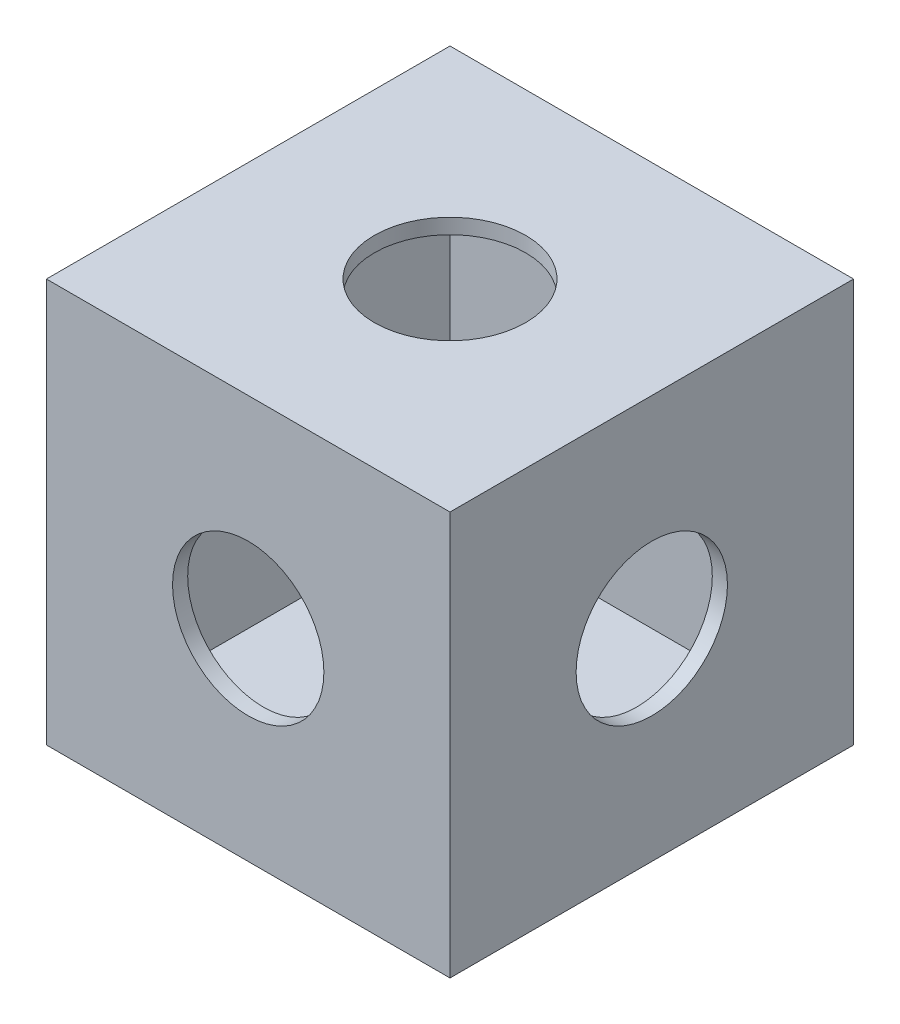
from build123d import *

# Parameters (mm, degrees)
SKETCH1_W           = 40
SKETCH1_H           = 40
BOSS_EXTRUDE2_DEPTH = 1.5
SKETCH2_W           = 40
SKETCH2_H           = 40
SKETCH2_W_2         = 37
SKETCH2_H_2         = 37
BOSS_EXTRUDE3_DEPTH = 37
SKETCH3_W           = 40
SKETCH3_H           = 40
BOSS_EXTRUDE4_DEPTH = 1.5
SKETCH4_R           = 7.5
CUT_EXTRUDE1_DEPTH  = 70.282032303
SKETCH5_R           = 7.5
CUT_EXTRUDE2_DEPTH  = 69.426968368
SKETCH6_R           = 7.5
CUT_EXTRUDE3_DEPTH  = 69.426968368


with BuildPart() as part:
    # Sketch1 → Boss-Extrude2 (new body)
    with BuildSketch(Plane(origin=(0, 0, 0), x_dir=(1, 0, 0), z_dir=(0, 1, 0))):
        with Locations((20, 20)):
            Rectangle(SKETCH1_W, SKETCH1_H)
    extrude(amount=-BOSS_EXTRUDE2_DEPTH)

    # Sketch2 → Boss-Extrude3 (add)
    with BuildSketch(Plane(origin=(0, 0, 0), x_dir=(1, 0, 0), z_dir=(0, 1, 0))):
        with Locations((20, 20)):
            Rectangle(SKETCH2_W, SKETCH2_H)
        with Locations((20, 20)):
            Rectangle(SKETCH2_W_2, SKETCH2_H_2, mode=Mode.SUBTRACT)
    extrude(amount=BOSS_EXTRUDE3_DEPTH)

    # Sketch3 → Boss-Extrude4 (add)
    with BuildSketch(Plane(origin=(0, 37, 0), x_dir=(1, 0, 0), z_dir=(0, 1, 0))):
        with Locations((20, 20)):
            Rectangle(SKETCH3_W, SKETCH3_H)
    extrude(amount=BOSS_EXTRUDE4_DEPTH)

    # Sketch4 → Cut-Extrude1 (cut, through all)
    with BuildSketch(Plane(origin=(0, 38.5, 0), x_dir=(1, 0, 0), z_dir=(0, 1, 0))):
        with Locations(Location((20, 20, 0), (0, 0, 270))):
            Circle(SKETCH4_R)
    extrude(amount=-CUT_EXTRUDE1_DEPTH, mode=Mode.SUBTRACT)

    # Sketch5 → Cut-Extrude2 (cut, through all)
    with BuildSketch(Plane(origin=(40, 0, 0), x_dir=(0, 0, -1), z_dir=(1, 0, 0))):
        with Locations((20, 18.5)):
            Circle(SKETCH5_R)
    extrude(amount=-CUT_EXTRUDE2_DEPTH, mode=Mode.SUBTRACT)

    # Sketch6 → Cut-Extrude3 (cut, through all)
    with BuildSketch(Plane.XY):
        with Locations((20, 18.5)):
            Circle(SKETCH6_R)
    extrude(amount=-CUT_EXTRUDE3_DEPTH, mode=Mode.SUBTRACT)


solid = part.part
